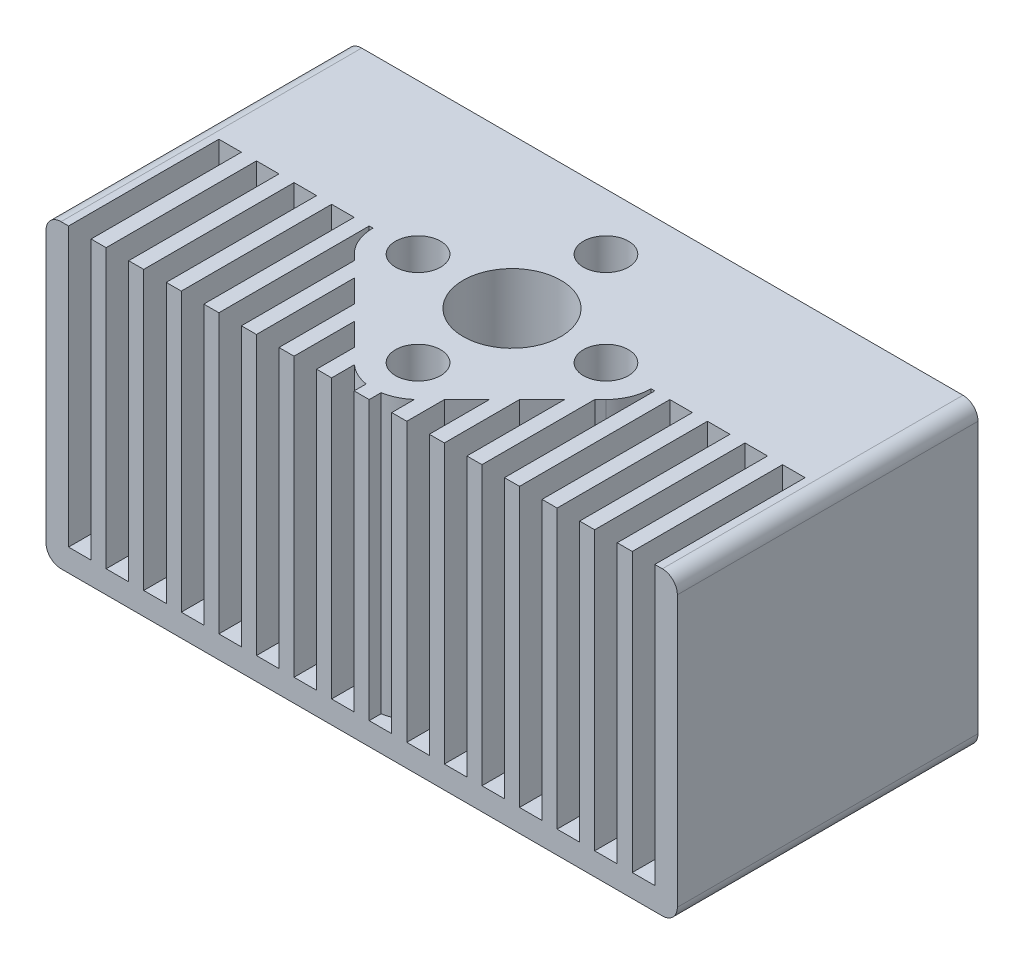
from build123d import *
from build123d.topology import SkipClean

# Parameters (mm, degrees)
SKETCH1_W           = 84
SKETCH1_H           = 40
BOSS_EXTRUDE1_DEPTH = 20
FILLET1_R           = 2
HOLE1_D             = 13
HOLE2_D             = 6
CUT_EXTRUDE2_DEPTH  = 17
RIB1_REACH          = 63.351
SKETCH10_WALLS_W    = 2
SKETCH10_WALLS_H    = 158.702893202
SKETCH12_W          = 3
SKETCH12_H          = 20
CUT_EXTRUDE3_DEPTH  = 60.439044407


with BuildPart() as part:
    # Sketch1 → Boss-Extrude1 (new, symmetric)
    with BuildSketch(Plane.XY):
        Rectangle(SKETCH1_W, SKETCH1_H)
    extrude(amount=BOSS_EXTRUDE1_DEPTH, both=True)

    # Fillet1
    fillet1_edges = [part.edges().sort_by_distance(p)[0] for p in [
        (42, -20, 0),
        (-42, -20, 0),
        (-42, 20, 0),
        (42, 20, 0),
    ]]
    fillet(fillet1_edges, radius=FILLET1_R)

    # Hole1 (through all)
    with Locations(Plane(origin=(0, 20, 0), x_dir=(1, 0, 0), z_dir=(0, 1, 0))):
        with Locations((0, 0)):
            Hole(HOLE1_D / 2)

    # Hole2 (through all)
    with Locations(Plane(origin=(0, 20, 0), x_dir=(1, 0, 0), z_dir=(0, 1, 0))):
        with Locations((12.5, 0), (0, -12.5), (-12.5, 0), (0, 12.5), (0, 0)):
            Hole(HOLE2_D / 2)

    # Sketch9 → Cut-Extrude2 (cut, symmetric)
    with BuildSketch(Plane(origin=(0, 0, 0), x_dir=(1, 0, 0), z_dir=(0, 1, 0))):
        with BuildLine():
            Line((-39, -20), (0, -20))
            Line((0, -20), (0, -18.5))
            ThreePointArc((0, -18.5), (-2.296100594, -18.043277195), (-4.242640687, -16.742640687))
            Line((-4.242640687, -16.742640687), (-16.742640687, -4.242640687))
            ThreePointArc((-16.742640687, -4.242640687), (-18.043277195, -2.296100594), (-18.5, 0))
            Line((-18.5, 0), (-39, 0))
            Line((-39, 0), (-39, -20))
        make_face()
        with BuildLine():
            Line((39, 0), (18.5, 0))
            ThreePointArc((18.5, 0), (18.043277195, -2.296100594), (16.742640687, -4.242640687))
            Line((16.742640687, -4.242640687), (4.242640687, -16.742640687))
            ThreePointArc((4.242640687, -16.742640687), (2.296100594, -18.043277195), (0, -18.5))
            Line((0, -18.5), (0, -20))
            Line((0, -20), (39, -20))
            Line((39, -20), (39, 0))
        make_face()
    extrude(amount=CUT_EXTRUDE2_DEPTH, both=True, mode=Mode.SUBTRACT)

    # Sketch10 walls → Rib1 (add, up to next)
    with BuildSketch(Plane.XY.offset(20), mode=Mode.PRIVATE) as rib1_sk1:
        Rectangle(SKETCH10_WALLS_W, SKETCH10_WALLS_H)
    rib1_tool1 = extrude(rib1_sk1.sketch, amount=-RIB1_REACH, mode=Mode.PRIVATE) - part.part
    # Sketch10 walls → Rib1 (add, up to next)
    with BuildSketch(Plane.XY.offset(20), mode=Mode.PRIVATE) as rib1_sk2:
        with Locations((5, 0)):
            Rectangle(SKETCH10_WALLS_W, SKETCH10_WALLS_H)
    rib1_tool2 = extrude(rib1_sk2.sketch, amount=-RIB1_REACH, mode=Mode.PRIVATE) - part.part
    # Sketch10 walls → Rib1 (add, up to next)
    with BuildSketch(Plane.XY.offset(20), mode=Mode.PRIVATE) as rib1_sk3:
        with Locations((10, 0)):
            Rectangle(SKETCH10_WALLS_W, SKETCH10_WALLS_H)
    rib1_tool3 = extrude(rib1_sk3.sketch, amount=-RIB1_REACH, mode=Mode.PRIVATE) - part.part
    # Sketch10 walls → Rib1 (add, up to next)
    with BuildSketch(Plane.XY.offset(20), mode=Mode.PRIVATE) as rib1_sk4:
        with Locations((15, 0)):
            Rectangle(SKETCH10_WALLS_W, SKETCH10_WALLS_H)
    rib1_tool4 = extrude(rib1_sk4.sketch, amount=-RIB1_REACH, mode=Mode.PRIVATE) - part.part
    # Sketch10 walls → Rib1 (add, up to next)
    with BuildSketch(Plane.XY.offset(20), mode=Mode.PRIVATE) as rib1_sk5:
        with Locations((20, 0)):
            Rectangle(SKETCH10_WALLS_W, SKETCH10_WALLS_H)
    rib1_tool5 = extrude(rib1_sk5.sketch, amount=-RIB1_REACH, mode=Mode.PRIVATE) - part.part
    # Sketch10 walls → Rib1 (add, up to next)
    with BuildSketch(Plane.XY.offset(20), mode=Mode.PRIVATE) as rib1_sk6:
        with Locations((25, 0)):
            Rectangle(SKETCH10_WALLS_W, SKETCH10_WALLS_H)
    rib1_tool6 = extrude(rib1_sk6.sketch, amount=-RIB1_REACH, mode=Mode.PRIVATE) - part.part
    # Sketch10 walls → Rib1 (add, up to next)
    with BuildSketch(Plane.XY.offset(20), mode=Mode.PRIVATE) as rib1_sk7:
        with Locations((30, 0)):
            Rectangle(SKETCH10_WALLS_W, SKETCH10_WALLS_H)
    rib1_tool7 = extrude(rib1_sk7.sketch, amount=-RIB1_REACH, mode=Mode.PRIVATE) - part.part
    # Sketch10 walls → Rib1 (add, up to next)
    with BuildSketch(Plane.XY.offset(20), mode=Mode.PRIVATE) as rib1_sk8:
        with Locations((35, 0)):
            Rectangle(SKETCH10_WALLS_W, SKETCH10_WALLS_H)
    rib1_tool8 = extrude(rib1_sk8.sketch, amount=-RIB1_REACH, mode=Mode.PRIVATE) - part.part
    # Sketch10 walls → Rib1 (add, up to next)
    with BuildSketch(Plane.XY.offset(20), mode=Mode.PRIVATE) as rib1_sk9:
        with Locations((-25, 0)):
            Rectangle(SKETCH10_WALLS_W, SKETCH10_WALLS_H)
    rib1_tool9 = extrude(rib1_sk9.sketch, amount=-RIB1_REACH, mode=Mode.PRIVATE) - part.part
    # Sketch10 walls → Rib1 (add, up to next)
    with BuildSketch(Plane.XY.offset(20), mode=Mode.PRIVATE) as rib1_sk10:
        with Locations((-20, 0)):
            Rectangle(SKETCH10_WALLS_W, SKETCH10_WALLS_H)
    rib1_tool10 = extrude(rib1_sk10.sketch, amount=-RIB1_REACH, mode=Mode.PRIVATE) - part.part
    # Sketch10 walls → Rib1 (add, up to next)
    with BuildSketch(Plane.XY.offset(20), mode=Mode.PRIVATE) as rib1_sk11:
        with Locations((-15, 0)):
            Rectangle(SKETCH10_WALLS_W, SKETCH10_WALLS_H)
    rib1_tool11 = extrude(rib1_sk11.sketch, amount=-RIB1_REACH, mode=Mode.PRIVATE) - part.part
    # Sketch10 walls → Rib1 (add, up to next)
    with BuildSketch(Plane.XY.offset(20), mode=Mode.PRIVATE) as rib1_sk12:
        with Locations((-10, 0)):
            Rectangle(SKETCH10_WALLS_W, SKETCH10_WALLS_H)
    rib1_tool12 = extrude(rib1_sk12.sketch, amount=-RIB1_REACH, mode=Mode.PRIVATE) - part.part
    # Sketch10 walls → Rib1 (add, up to next)
    with BuildSketch(Plane.XY.offset(20), mode=Mode.PRIVATE) as rib1_sk13:
        with Locations((-5, 0)):
            Rectangle(SKETCH10_WALLS_W, SKETCH10_WALLS_H)
    rib1_tool13 = extrude(rib1_sk13.sketch, amount=-RIB1_REACH, mode=Mode.PRIVATE) - part.part
    # Sketch10 walls → Rib1 (add, up to next)
    with BuildSketch(Plane.XY.offset(20), mode=Mode.PRIVATE) as rib1_sk14:
        with Locations((-30, 0)):
            Rectangle(SKETCH10_WALLS_W, SKETCH10_WALLS_H)
    rib1_tool14 = extrude(rib1_sk14.sketch, amount=-RIB1_REACH, mode=Mode.PRIVATE) - part.part
    # Sketch10 walls → Rib1 (add, up to next)
    with BuildSketch(Plane.XY.offset(20), mode=Mode.PRIVATE) as rib1_sk15:
        with Locations((-35, 0)):
            Rectangle(SKETCH10_WALLS_W, SKETCH10_WALLS_H)
    rib1_tool15 = extrude(rib1_sk15.sketch, amount=-RIB1_REACH, mode=Mode.PRIVATE) - part.part
    add(rib1_tool1.solids().sort_by_distance((0, 0, 20))[0])
    add(rib1_tool2.solids().sort_by_distance((5, 0, 20))[0])
    add(rib1_tool3.solids().sort_by_distance((10, 0, 20))[0])
    add(rib1_tool4.solids().sort_by_distance((15, 0, 20))[0])
    add(rib1_tool5.solids().sort_by_distance((20, 0, 20))[0])
    add(rib1_tool6.solids().sort_by_distance((25, 0, 20))[0])
    add(rib1_tool7.solids().sort_by_distance((30, 0, 20))[0])
    add(rib1_tool8.solids().sort_by_distance((35, 0, 20))[0])
    add(rib1_tool9.solids().sort_by_distance((-25, 0, 20))[0])
    add(rib1_tool10.solids().sort_by_distance((-20, 0, 20))[0])
    add(rib1_tool11.solids().sort_by_distance((-15, 0, 20))[0])
    add(rib1_tool12.solids().sort_by_distance((-10, 0, 20))[0])
    add(rib1_tool13.solids().sort_by_distance((-5, 0, 20))[0])
    add(rib1_tool14.solids().sort_by_distance((-30, 0, 20))[0])
    add(rib1_tool15.solids().sort_by_distance((-35, 0, 20))[0])

    # Sketch12 → Cut-Extrude3 (cut, through all)
    with SkipClean():  # the faces are left unmerged after this step: merging them gives an invalid solid
        with BuildSketch(Plane.XZ.offset(-17)):
            with Locations((37.5, 10)):
                Rectangle(SKETCH12_W, SKETCH12_H)
            with Locations((32.5, 10)):
                Rectangle(SKETCH12_W, SKETCH12_H)
            with Locations((27.5, 10)):
                Rectangle(SKETCH12_W, SKETCH12_H)
            with Locations((22.5, 10)):
                Rectangle(SKETCH12_W, SKETCH12_H)
            with BuildLine():
                Line((18.5, 0), (19, 0))
                Line((19, 0), (19, 20))
                Line((19, 20), (16, 20))
                Line((16, 20), (16, 4.985281374))
                Line((16, 4.985281374), (16.742640687, 4.242640687))
                ThreePointArc((16.742640687, 4.242640687), (18.043277195, 2.296100594), (18.5, 0))
            make_face()
            Polygon((11, 9.985281374), (14, 6.985281374), (14, 20), (11, 20), align=None)
            Polygon((6, 14.985281374), (9, 11.985281374), (9, 20), (6, 20), align=None)
            with BuildLine():
                Line((4, 16.972135955), (4, 20))
                Line((4, 20), (1, 20))
                Line((1, 20), (1, 18.416079783))
                ThreePointArc((1, 18.416079783), (2.602161303, 17.906362599), (4, 16.972135955))
            make_face()
            with BuildLine():
                Line((-4, 20), (-4, 16.972135955))
                ThreePointArc((-4, 16.972135955), (-2.602161303, 17.906362599), (-1, 18.416079783))
                Line((-1, 18.416079783), (-1, 20))
                Line((-1, 20), (-4, 20))
            make_face()
            Polygon((-9, 11.985281374), (-6, 14.985281374), (-6, 20), (-9, 20), align=None)
            Polygon((-14, 6.985281374), (-11, 9.985281374), (-11, 20), (-14, 20), align=None)
            with BuildLine():
                Line((-16.742640687, 4.242640687), (-16, 4.985281374))
                Line((-16, 4.985281374), (-16, 20))
                Line((-16, 20), (-19, 20))
                Line((-19, 20), (-19, 0))
                Line((-19, 0), (-18.5, 0))
                ThreePointArc((-18.5, 0), (-18.043277195, 2.296100594), (-16.742640687, 4.242640687))
            make_face()
            with Locations((-22.5, 10)):
                Rectangle(SKETCH12_W, SKETCH12_H)
            with Locations((-27.5, 10)):
                Rectangle(SKETCH12_W, SKETCH12_H)
            with Locations((-32.5, 10)):
                Rectangle(SKETCH12_W, SKETCH12_H)
            with Locations((-37.5, 10)):
                Rectangle(SKETCH12_W, SKETCH12_H)
        extrude(amount=-CUT_EXTRUDE3_DEPTH, mode=Mode.SUBTRACT)


solid = part.part
